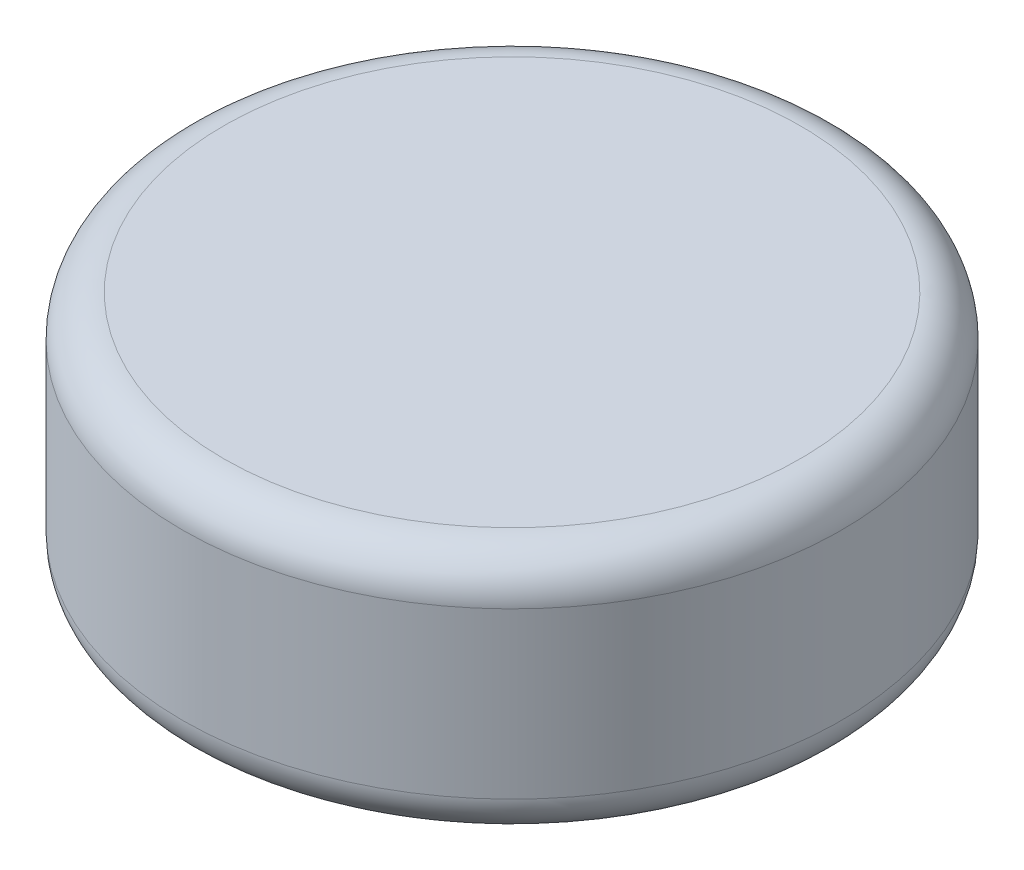
from build123d import *

# Parameters (mm, degrees)
SKETCH1_R           = 2
BOSS_EXTRUDE1_DEPTH = 1.5
FILLET1_R           = 0.25


with BuildPart() as part:
    # Sketch1 → Boss-Extrude1 (new body)
    with BuildSketch(Plane(origin=(0, 0, 0), x_dir=(1, 0, 0), z_dir=(0, 1, 0))):
        with Locations(Location((0, 0, 0), (0, 0, 270))):
            Circle(SKETCH1_R)
    extrude(amount=BOSS_EXTRUDE1_DEPTH)

    # Fillet1
    fillet1_edges = [part.edges().sort_by_distance(p)[0] for p in [
        (0, 0, -2),
        (0, 1.5, -2),
    ]]
    fillet(fillet1_edges, radius=FILLET1_R)


solid = part.part
